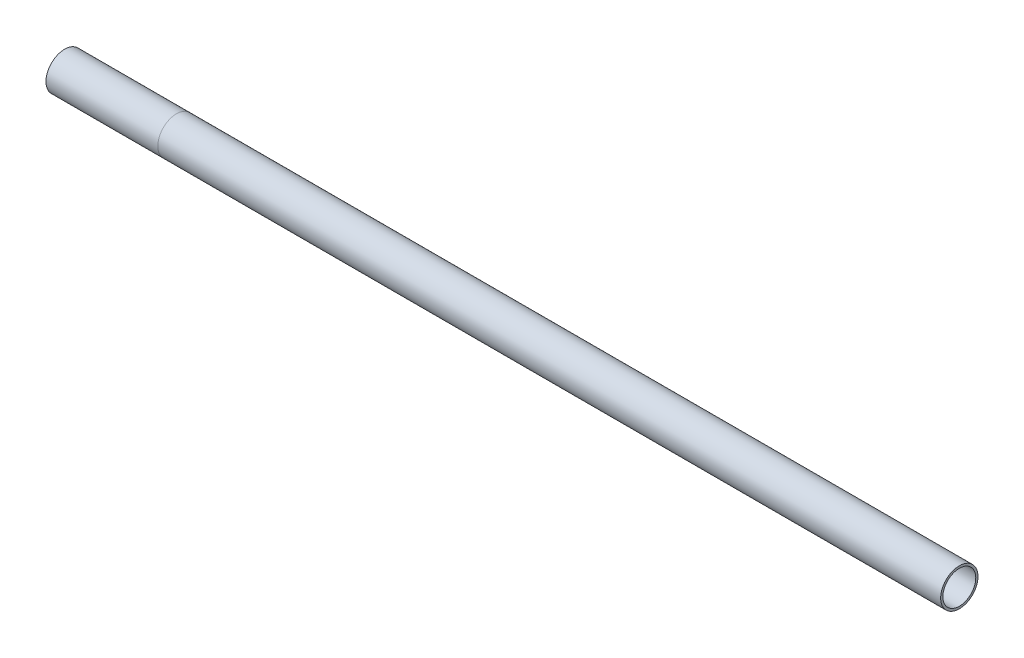
from build123d import *

# Parameters (mm, degrees)
SKETCH1_R   = 8.35
SKETCH1_R_2 = 7.35


with BuildPart() as part:
    # Sweep1: sweep along a path in Sketch2
    with BuildLine(Plane.XY) as sweep1_path:
        Line((0, 5.184170518), (50, 5.184170518))
        Line((50, 5.184170518), (400, 5.184170518))
    # Sketch1 → Sweep1 (sweep)
    with BuildSketch(Plane(origin=(0, 0, 0), x_dir=(0, 0, -1), z_dir=(1, 0, 0))):
        with Locations((-2.719564862, 5.184170518)):
            Circle(SKETCH1_R)
        with Locations((-2.719564862, 5.184170518)):
            Circle(SKETCH1_R_2, mode=Mode.SUBTRACT)
    sweep(path=sweep1_path.line)


solid = part.part
